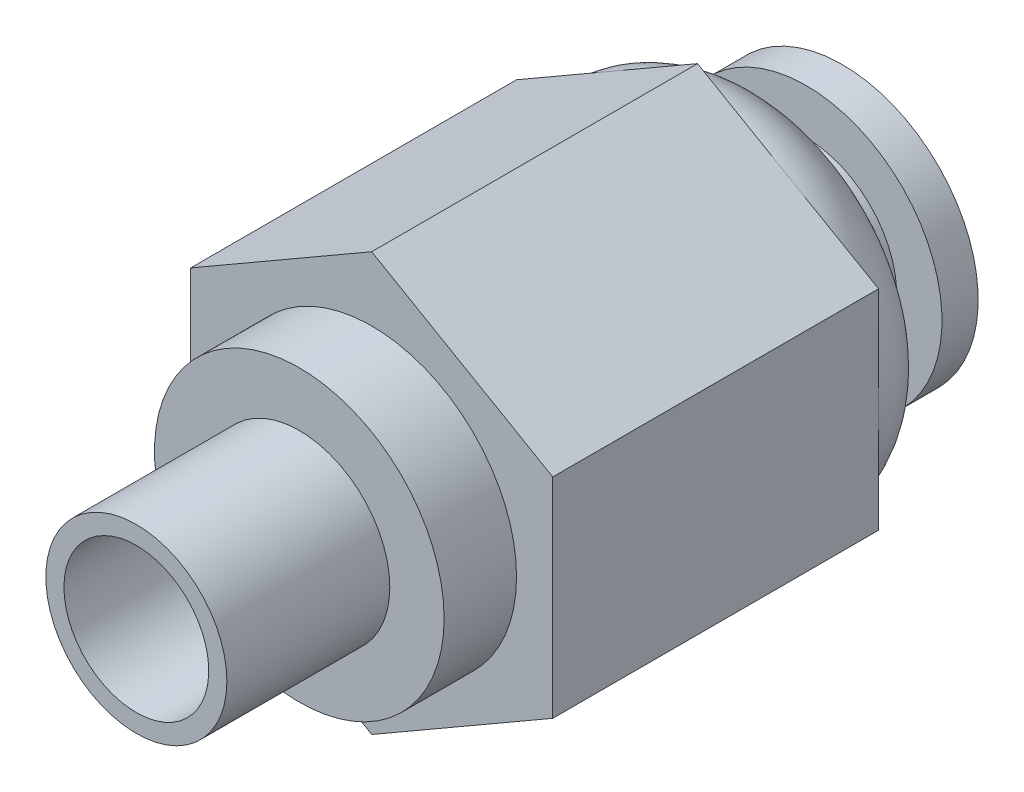
from build123d import *

# Parameters (mm, degrees)
EXTRUDE_1_DEPTH     = 9
SKETCH_2_R          = 4
EXTRUDE_2_DEPTH     = 2
SKETCH_3_R          = 2.5
EXTRUDE_3_DEPTH     = 4.5
EXTRUDE_START       = 1
SKETCH_5_R          = 2.5
EXTRUDE_4_DEPTH     = 1
SKETCH_6_R          = 3.75
EXTRUDE_5_DEPTH     = 1
SKETCH_7_R          = 2
CUT_EXTRUDE_1_DEPTH = 21.942381272


with BuildPart() as part:
    # 草图1 → 凸台-拉伸1 (new body)
    with BuildSketch(Plane.XY):
        Polygon((5, 2.886751346), (0, 5.773502692), (-5, 2.886751346), (-5, -2.886751346), (0, -5.773502692), (5, -2.886751346), align=None)
    extrude(amount=EXTRUDE_1_DEPTH)

    # 草图2 → 凸台-拉伸2 (add)
    with BuildSketch(Plane.XY.offset(9)):
        Circle(SKETCH_2_R)
    extrude(amount=EXTRUDE_2_DEPTH)

    # 草图3 → 凸台-拉伸3 (add)
    with BuildSketch(Plane.XY.offset(11)):
        Circle(SKETCH_3_R)
    extrude(amount=EXTRUDE_3_DEPTH)

    # 草图4 → 旋转1 (revolve)
    with BuildSketch(Plane(origin=(0, 0, 0), x_dir=(1, 0, 0), z_dir=(0, 1, 0))):
        with BuildLine():
            Line((0, 0), (0, 2))
            Line((0, 2), (3, 2))
            ThreePointArc((3, 2), (4.414213562, 1.414213562), (5, 0))
            Line((5, 0), (0, 0))
        make_face()
    revolve(axis=Axis((0, 0, 0), (0, 0, -1)))

    # 草图5 → 凸台-拉伸4 (add)
    with BuildSketch(Plane(origin=(0, 0, -2), x_dir=(-1, 0, 0), z_dir=(0, 0, -1)).offset(EXTRUDE_START)):
        with Locations(Location((0, 0, 0), (0, 0, 180))):
            Circle(SKETCH_5_R)
    extrude(amount=-EXTRUDE_4_DEPTH)

    # 草图6 → 凸台-拉伸5 (add)
    with BuildSketch(Plane(origin=(0, 0, -3), x_dir=(-1, 0, 0), z_dir=(0, 0, -1))):
        Circle(SKETCH_6_R)
    extrude(amount=EXTRUDE_5_DEPTH)

    # 草图7 → 切除-拉伸1 (cut, through all)
    with BuildSketch(Plane(origin=(0, 0, -4), x_dir=(-1, 0, 0), z_dir=(0, 0, -1))):
        Circle(SKETCH_7_R)
    extrude(amount=-CUT_EXTRUDE_1_DEPTH, mode=Mode.SUBTRACT)


solid = part.part
